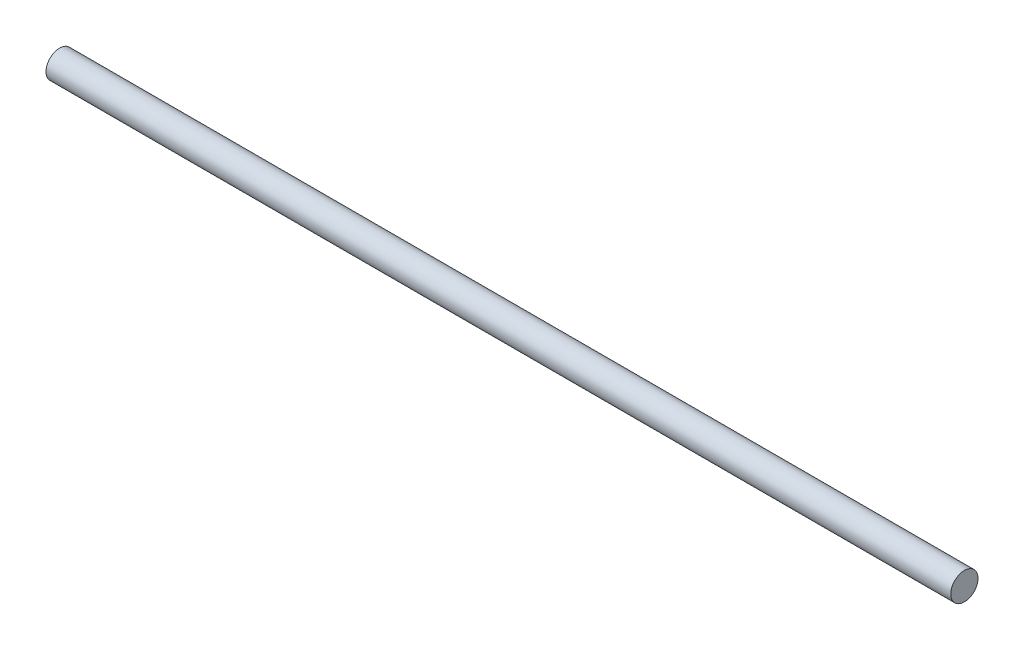
from build123d import *

# Parameters (mm, degrees)
SKETCH1_R           = 7.5
BOSS_EXTRUDE1_DEPTH = 497.5


with BuildPart() as part:
    # Sketch1 → Boss-Extrude1 (new body)
    with BuildSketch(Plane(origin=(0, 0, 0), x_dir=(0, 0, -1), z_dir=(1, 0, 0))):
        with Locations(Location((0, 0, 0), (0, 0, 180))):
            Circle(SKETCH1_R)
    extrude(amount=BOSS_EXTRUDE1_DEPTH)


solid = part.part
